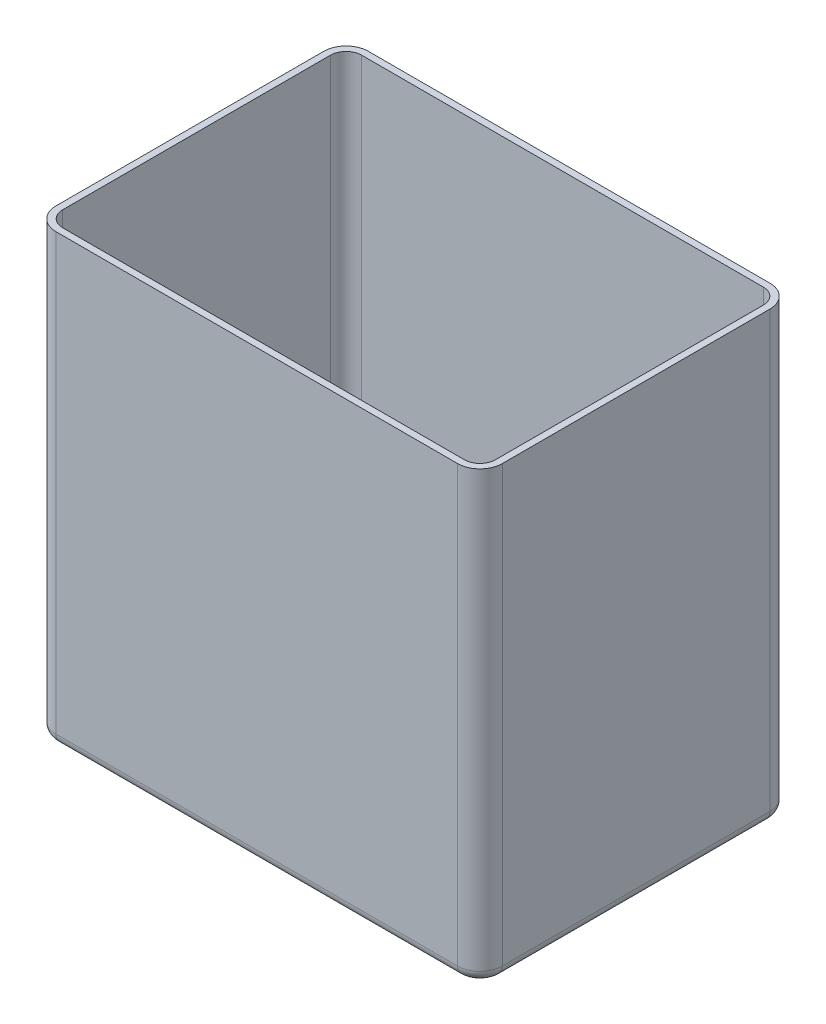
from build123d import *

# Parameters (mm, degrees)
CROQUIS1_W     = 200
CROQUIS1_H     = 140
EXTRUIR1_DEPTH = 200
REDONDEO1_R    = 10
REDONDEO2_R    = 5
VACIADO1_T     = -3


with BuildPart() as part:
    # Croquis1 → Extruir1 (new body)
    with BuildSketch(Plane(origin=(0, 0, 0), x_dir=(1, 0, 0), z_dir=(0, 1, 0))):
        Rectangle(CROQUIS1_W, CROQUIS1_H)
    extrude(amount=-EXTRUIR1_DEPTH)

    # Redondeo1
    redondeo1_edges = [part.edges().sort_by_distance(p)[0] for p in [
        (-100, -100, -70),
        (100, -100, -70),
        (100, -100, 70),
        (-100, -100, 70),
    ]]
    fillet(redondeo1_edges, radius=REDONDEO1_R)

    # Redondeo2
    redondeo2_edges = [part.edges().sort_by_distance(p)[0] for p in [
        (-100, -200, 0),
        (0, -200, 70),
        (0, -200, -70),
        (100, -200, 0),
        (97.071067812, -200, -67.071067812),
        (97.071067812, -200, 67.071067812),
        (-97.071067812, -200, -67.071067812),
        (-97.071067812, -200, 67.071067812),
    ]]
    fillet(redondeo2_edges, radius=REDONDEO2_R)

    # Vaciado1
    vaciado1_openings = [part.faces().sort_by_distance(p)[0] for p in [
        (0, 0, 0),
    ]]
    offset(amount=VACIADO1_T, openings=vaciado1_openings, kind=Kind.INTERSECTION)


solid = part.part
